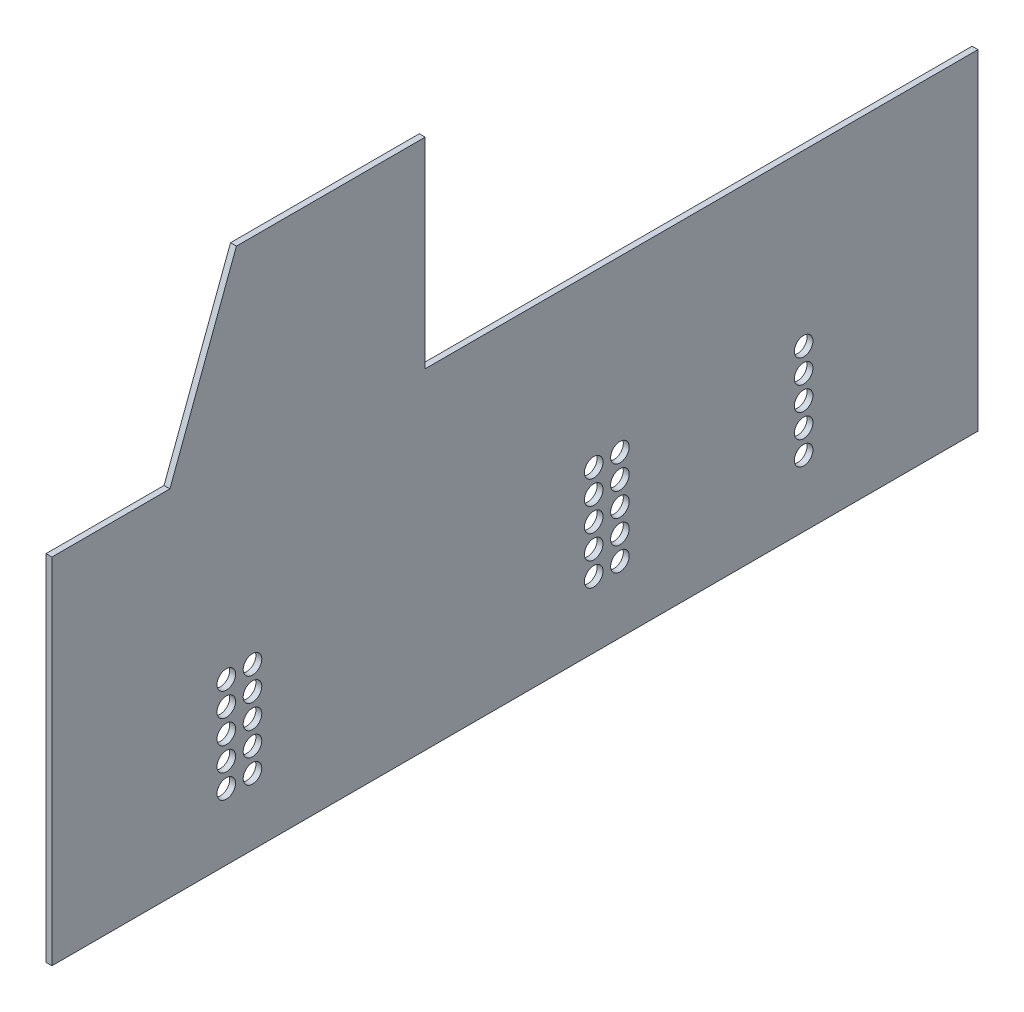
from build123d import *

# Parameters (mm, degrees)
SKETCH1_W                 = 498.348
SKETCH1_H                 = 177.8
BOSS_EXTRUDE1_DEPTH       = 1.5875
BOSS_EXTRUDE2_DEPTH       = 3.175
SKETCH3_R                 = 5
CUT_EXTRUDE3_DEPTH        = 318.565245896
LPATTERN3_COUNT           = 3
LPATTERN3_PITCH           = 12.7
LPATTERN3_COL_COUNT       = 3
LPATTERN3_COL_PITCH       = 12.7
LPATTERN4_COUNT           = 2
LPATTERN4_PITCH           = 197.7136
LPATTERN4_COPY_1_SKETCH_R = 5
LPATTERN4_COPY_1_DEPTH    = 318.565245896
LPATTERN4_COPY_2_SKETCH_R = 5
LPATTERN4_COPY_2_DEPTH    = 318.565245896
LPATTERN4_COPY_3_SKETCH_R = 5
LPATTERN4_COPY_3_DEPTH    = 318.565245896
LPATTERN4_COPY_4_SKETCH_R = 5
LPATTERN4_COPY_4_DEPTH    = 318.565245896
SKETCH5_R                 = 5
CUT_EXTRUDE4_DEPTH        = 318.565245896
LPATTERN5_COUNT           = 3
LPATTERN5_PITCH           = 12.7
LPATTERN5_COL_COUNT       = 3
LPATTERN5_COL_PITCH       = 12.7
LPATTERN6_COUNT           = 4
LPATTERN6_PITCH           = 98.8568
LPATTERN6_COPY_1_SKETCH_R = 5
LPATTERN6_COPY_1_DEPTH    = 318.565245896
LPATTERN6_COPY_2_SKETCH_R = 5
LPATTERN6_COPY_2_DEPTH    = 318.565245896
LPATTERN6_COPY_3_SKETCH_R = 5
LPATTERN6_COPY_3_DEPTH    = 318.565245896
LPATTERN6_COPY_4_SKETCH_R = 5
LPATTERN6_COPY_4_DEPTH    = 318.565245896
LPATTERN6_COPY_5_SKETCH_R = 5
LPATTERN6_COPY_5_DEPTH    = 318.565245896
LPATTERN6_COPY_6_SKETCH_R = 5
LPATTERN6_COPY_6_DEPTH    = 318.565245896
LPATTERN6_COPY_7_SKETCH_R = 5
LPATTERN6_COPY_7_DEPTH    = 318.565245896
LPATTERN6_COPY_8_SKETCH_R = 5
LPATTERN6_COPY_8_DEPTH    = 318.565245896


with BuildPart() as part:
    # Sketch1 → Boss-Extrude1 (new, symmetric)
    with BuildSketch(Plane(origin=(0, 0, 0), x_dir=(0, 0, -1), z_dir=(1, 0, 0))):
        Rectangle(SKETCH1_W, SKETCH1_H)
    extrude(amount=BOSS_EXTRUDE1_DEPTH, both=True)

    # Sketch2 → Boss-Extrude2 (add)
    with BuildSketch(Plane.ZY.offset(1.5875)):
        Polygon((48.2854, 196.85), (48.2854, 88.9), (249.174, 88.9), (249.174, 101.6), (185.674, 101.6), (149.8854, 196.85), align=None)
    extrude(amount=-BOSS_EXTRUDE2_DEPTH)

    # Sketch3 → Cut-Extrude3 (cut, through all)
    with BuildSketch(Plane.ZY.offset(1.5875)):
        with Locations((155.3337, -27.7749)):
            Circle(SKETCH3_R)
    cut_extrude3 = extrude(amount=-CUT_EXTRUDE3_DEPTH, mode=Mode.SUBTRACT)

    # LPattern3: Cut-Extrude3 ×3
    with Locations(*[(0, i * LPATTERN3_PITCH, 0) for i in range(1, LPATTERN3_COUNT)]):
        add(cut_extrude3, mode=Mode.SUBTRACT)

    # LPattern3 col: Cut-Extrude3 ×3
    with Locations(*[(0, -i * LPATTERN3_COL_PITCH, 0) for i in range(1, LPATTERN3_COL_COUNT)]):
        add(cut_extrude3, mode=Mode.SUBTRACT)

    # LPattern4: Cut-Extrude3 ×2
    with Locations(*[(0, 0, -i * LPATTERN4_PITCH) for i in range(1, LPATTERN4_COUNT)]):
        add(cut_extrude3, mode=Mode.SUBTRACT)

    # LPattern4 copy 1 sketch → LPattern4 copy 1 (cut, through all)
    with BuildSketch(Plane(origin=(-1.5875, 12.7, -197.7136), x_dir=(0, 0, 1), z_dir=(-1, 0, 0))):
        with Locations((155.3337, -27.7749)):
            Circle(LPATTERN4_COPY_1_SKETCH_R)
    extrude(amount=-LPATTERN4_COPY_1_DEPTH, mode=Mode.SUBTRACT)

    # LPattern4 copy 2 sketch → LPattern4 copy 2 (cut, through all)
    with BuildSketch(Plane(origin=(-1.5875, 25.4, -197.7136), x_dir=(0, 0, 1), z_dir=(-1, 0, 0))):
        with Locations((155.3337, -27.7749)):
            Circle(LPATTERN4_COPY_2_SKETCH_R)
    extrude(amount=-LPATTERN4_COPY_2_DEPTH, mode=Mode.SUBTRACT)

    # LPattern4 copy 3 sketch → LPattern4 copy 3 (cut, through all)
    with BuildSketch(Plane(origin=(-1.5875, -12.7, -197.7136), x_dir=(0, 0, 1), z_dir=(-1, 0, 0))):
        with Locations((155.3337, -27.7749)):
            Circle(LPATTERN4_COPY_3_SKETCH_R)
    extrude(amount=-LPATTERN4_COPY_3_DEPTH, mode=Mode.SUBTRACT)

    # LPattern4 copy 4 sketch → LPattern4 copy 4 (cut, through all)
    with BuildSketch(Plane(origin=(-1.5875, -25.4, -197.7136), x_dir=(0, 0, 1), z_dir=(-1, 0, 0))):
        with Locations((155.3337, -27.7749)):
            Circle(LPATTERN4_COPY_4_SKETCH_R)
    extrude(amount=-LPATTERN4_COPY_4_DEPTH, mode=Mode.SUBTRACT)

    # Sketch5 → Cut-Extrude4 (cut, through all)
    with BuildSketch(Plane.ZY.offset(1.5875)):
        with Locations((141.2367, -27.7749)):
            Circle(SKETCH5_R)
    cut_extrude4 = extrude(amount=-CUT_EXTRUDE4_DEPTH, mode=Mode.SUBTRACT)

    # LPattern5: Cut-Extrude4 ×3
    with Locations(*[(0, i * LPATTERN5_PITCH, 0) for i in range(1, LPATTERN5_COUNT)]):
        add(cut_extrude4, mode=Mode.SUBTRACT)

    # LPattern5 col: Cut-Extrude4 ×3
    with Locations(*[(0, -i * LPATTERN5_COL_PITCH, 0) for i in range(1, LPATTERN5_COL_COUNT)]):
        add(cut_extrude4, mode=Mode.SUBTRACT)

    # LPattern6: Cut-Extrude4 ×4, 1 skipped
    with Locations(*[(0, 0, -i * LPATTERN6_PITCH) for i in range(1, LPATTERN6_COUNT) if i not in (1,)]):
        add(cut_extrude4, mode=Mode.SUBTRACT)

    # LPattern6 copy 1 sketch → LPattern6 copy 1 (cut, through all)
    with BuildSketch(Plane(origin=(-1.5875, 12.7, -197.7136), x_dir=(0, 0, 1), z_dir=(-1, 0, 0))):
        with Locations((141.2367, -27.7749)):
            Circle(LPATTERN6_COPY_1_SKETCH_R)
    extrude(amount=-LPATTERN6_COPY_1_DEPTH, mode=Mode.SUBTRACT)

    # LPattern6 copy 2 sketch → LPattern6 copy 2 (cut, through all)
    with BuildSketch(Plane(origin=(-1.5875, 12.7, -296.5704), x_dir=(0, 0, 1), z_dir=(-1, 0, 0))):
        with Locations((141.2367, -27.7749)):
            Circle(LPATTERN6_COPY_2_SKETCH_R)
    extrude(amount=-LPATTERN6_COPY_2_DEPTH, mode=Mode.SUBTRACT)

    # LPattern6 copy 3 sketch → LPattern6 copy 3 (cut, through all)
    with BuildSketch(Plane(origin=(-1.5875, 25.4, -197.7136), x_dir=(0, 0, 1), z_dir=(-1, 0, 0))):
        with Locations((141.2367, -27.7749)):
            Circle(LPATTERN6_COPY_3_SKETCH_R)
    extrude(amount=-LPATTERN6_COPY_3_DEPTH, mode=Mode.SUBTRACT)

    # LPattern6 copy 4 sketch → LPattern6 copy 4 (cut, through all)
    with BuildSketch(Plane(origin=(-1.5875, 25.4, -296.5704), x_dir=(0, 0, 1), z_dir=(-1, 0, 0))):
        with Locations((141.2367, -27.7749)):
            Circle(LPATTERN6_COPY_4_SKETCH_R)
    extrude(amount=-LPATTERN6_COPY_4_DEPTH, mode=Mode.SUBTRACT)

    # LPattern6 copy 5 sketch → LPattern6 copy 5 (cut, through all)
    with BuildSketch(Plane(origin=(-1.5875, -12.7, -197.7136), x_dir=(0, 0, 1), z_dir=(-1, 0, 0))):
        with Locations((141.2367, -27.7749)):
            Circle(LPATTERN6_COPY_5_SKETCH_R)
    extrude(amount=-LPATTERN6_COPY_5_DEPTH, mode=Mode.SUBTRACT)

    # LPattern6 copy 6 sketch → LPattern6 copy 6 (cut, through all)
    with BuildSketch(Plane(origin=(-1.5875, -12.7, -296.5704), x_dir=(0, 0, 1), z_dir=(-1, 0, 0))):
        with Locations((141.2367, -27.7749)):
            Circle(LPATTERN6_COPY_6_SKETCH_R)
    extrude(amount=-LPATTERN6_COPY_6_DEPTH, mode=Mode.SUBTRACT)

    # LPattern6 copy 7 sketch → LPattern6 copy 7 (cut, through all)
    with BuildSketch(Plane(origin=(-1.5875, -25.4, -197.7136), x_dir=(0, 0, 1), z_dir=(-1, 0, 0))):
        with Locations((141.2367, -27.7749)):
            Circle(LPATTERN6_COPY_7_SKETCH_R)
    extrude(amount=-LPATTERN6_COPY_7_DEPTH, mode=Mode.SUBTRACT)

    # LPattern6 copy 8 sketch → LPattern6 copy 8 (cut, through all)
    with BuildSketch(Plane(origin=(-1.5875, -25.4, -296.5704), x_dir=(0, 0, 1), z_dir=(-1, 0, 0))):
        with Locations((141.2367, -27.7749)):
            Circle(LPATTERN6_COPY_8_SKETCH_R)
    extrude(amount=-LPATTERN6_COPY_8_DEPTH, mode=Mode.SUBTRACT)


solid = part.part
